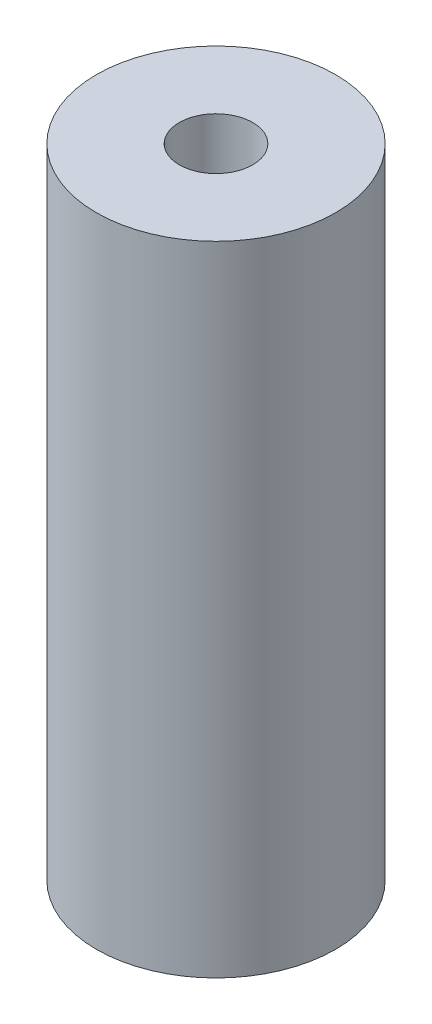
from build123d import *

# Parameters (mm, degrees)
SKETCH1_R           = 4.7625
SKETCH1_R_2         = 1.4605
BOSS_EXTRUDE1_DEPTH = 25.4


with BuildPart() as part:
    # Sketch1 → Boss-Extrude1 (new body)
    with BuildSketch(Plane(origin=(0, 0, 0), x_dir=(1, 0, 0), z_dir=(0, 1, 0))):
        with Locations(Location((0, 0, 0), (0, 0, 270))):
            Circle(SKETCH1_R)
        with Locations(Location((0, 0, 0), (0, 0, 270))):
            Circle(SKETCH1_R_2, mode=Mode.SUBTRACT)
    extrude(amount=BOSS_EXTRUDE1_DEPTH)


solid = part.part
